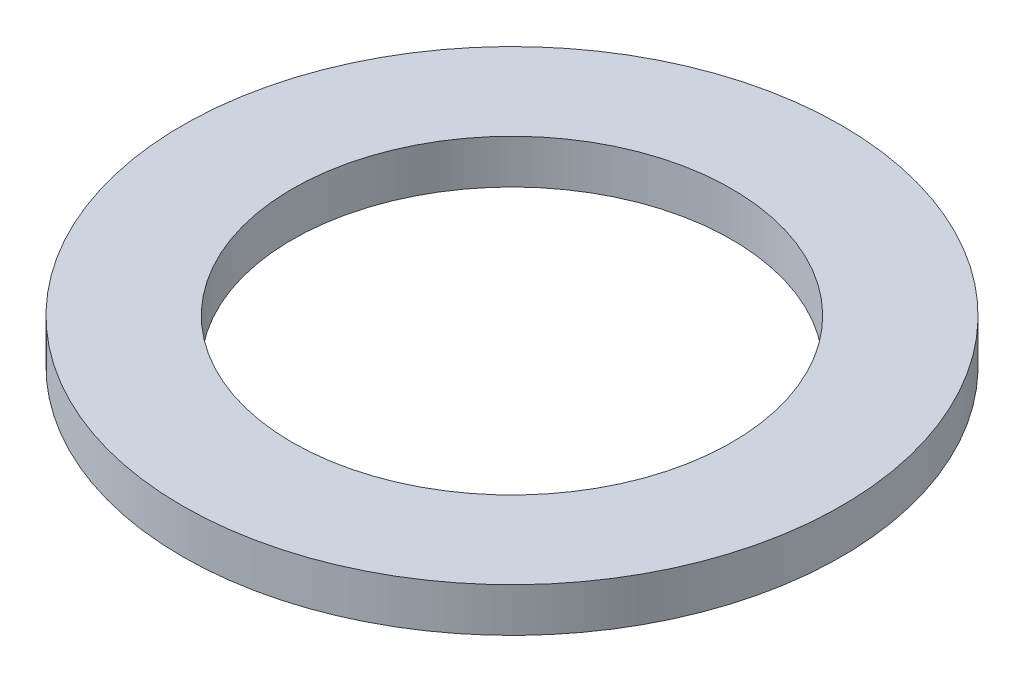
from build123d import *

# Parameters (mm, degrees)
SKETCH1_R           = 4.7625
BOSS_EXTRUDE1_DEPTH = 0.635
SKETCH5_R           = 3.175
CUT_EXTRUDE1_DEPTH  = 7.765060051


with BuildPart() as part:
    # Sketch1 → Boss-Extrude1 (new body)
    with BuildSketch(Plane(origin=(0, 0, 0), x_dir=(1, 0, 0), z_dir=(0, 1, 0))):
        with Locations(Location((0, 0, 0), (0, 0, 270))):
            Circle(SKETCH1_R)
    extrude(amount=BOSS_EXTRUDE1_DEPTH)

    # Sketch5 → Cut-Extrude1 (cut, through all)
    with BuildSketch(Plane(origin=(0, 0.635, 0), x_dir=(-1, 0, 0), z_dir=(0, 1, 0))):
        with Locations(Location((0, 0, 0), (0, 0, 90))):
            Circle(SKETCH5_R)
    extrude(amount=-CUT_EXTRUDE1_DEPTH, mode=Mode.SUBTRACT)


solid = part.part
